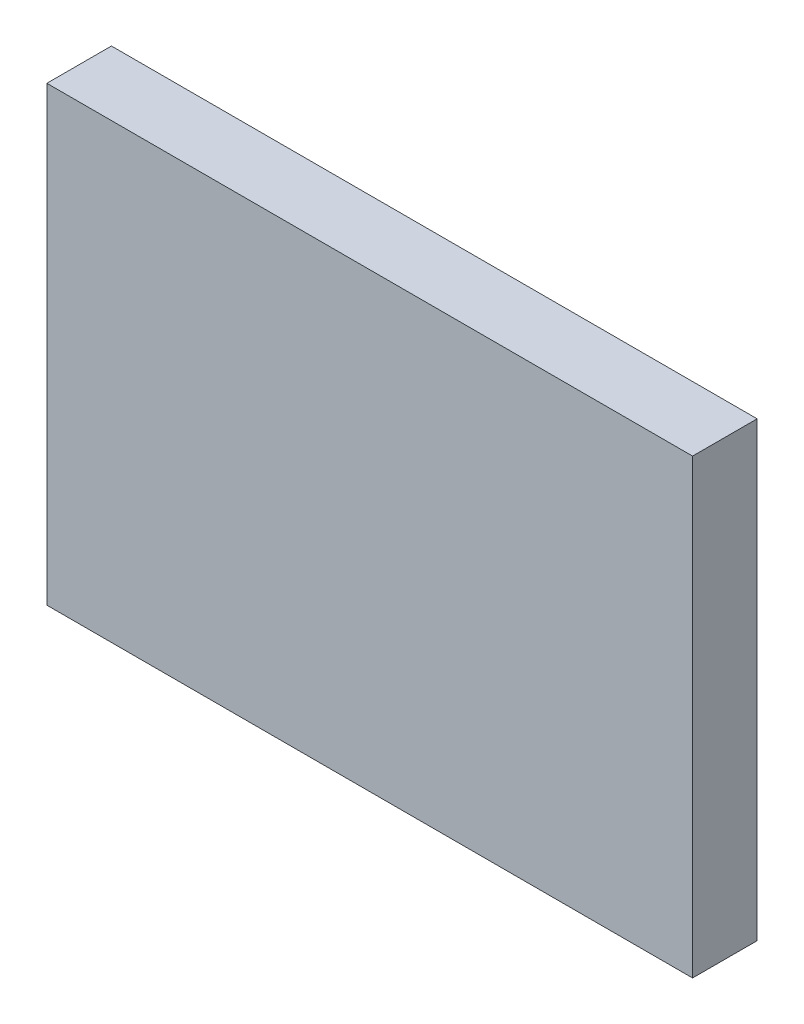
from build123d import *

# Parameters (mm, degrees)
SKETCH_1_W      = 10
SKETCH_1_H      = 7
EXTRUDE_1_DEPTH = 1


with BuildPart() as part:
    # 草图1 → 凸台-拉伸1 (new body)
    with BuildSketch(Plane.XY):
        Rectangle(SKETCH_1_W, SKETCH_1_H)
    extrude(amount=EXTRUDE_1_DEPTH)


solid = part.part
